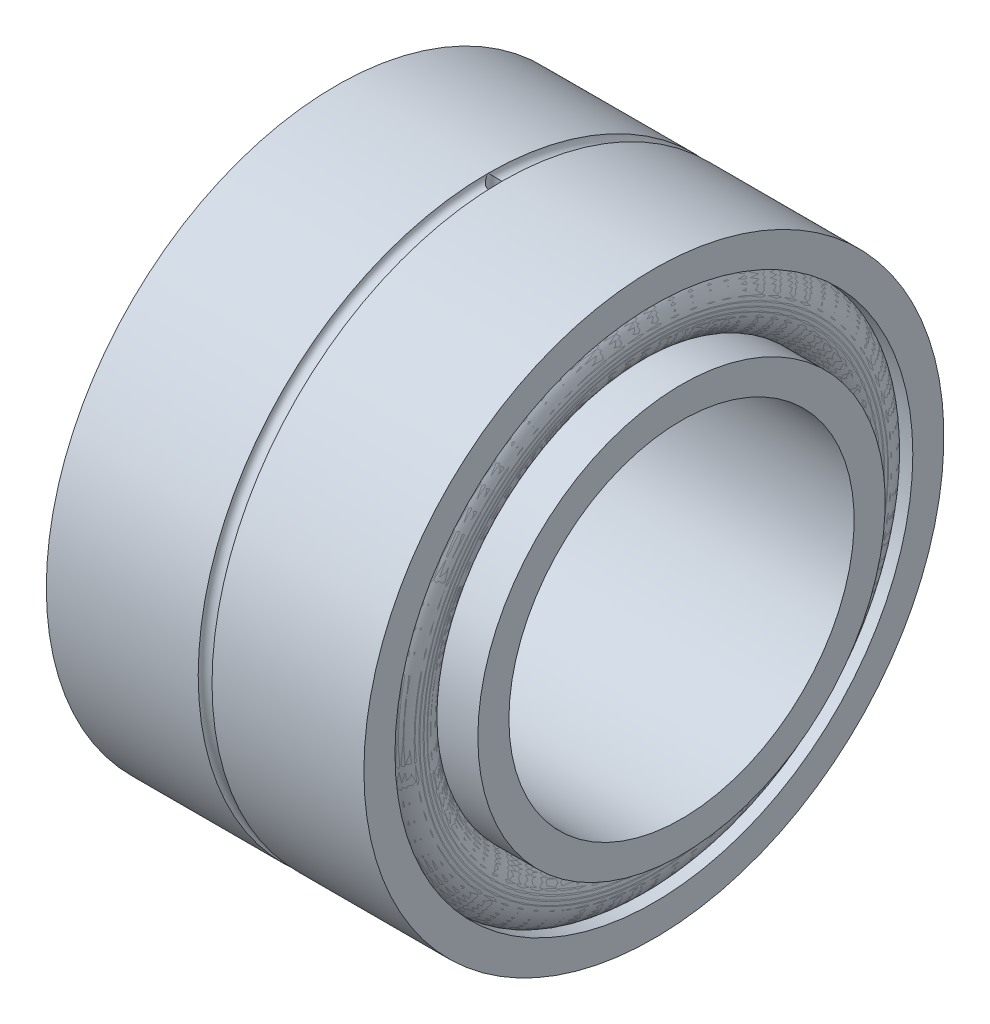
from build123d import *

# Parameters (mm, degrees)
SKIZZE1_R                       = 2.5
SKIZZE1_W                       = 14.985667851
SKIZZE1_H                       = 5
SKIZZE2_R                       = 0.5
SCHNITT_LINEAR_AUSTRAGEN1_DEPTH = 10


with BuildPart() as part:
    # Skizze1 → Rotation1 (revolve)
    with BuildSketch(Plane.XY, mode=Mode.PRIVATE) as rotation1_sk:
        with BuildLine():
            Line((0, 14.75), (0, 12.5))
            Line((0, 12.5), (25, 12.5))
            Line((25, 12.5), (25, 14.75))
            Line((25, 14.75), (22, 14.75))
            ThreePointArc((22, 14.75), (22.999333925, 16.75), (22, 18.75))
            Line((22, 18.75), (23, 18.75))
            Line((23, 18.75), (23, 21))
            Line((23, 21), (12, 21))
            ThreePointArc((12, 21), (11.5, 20.5), (11, 21))
            Line((11, 21), (0, 21))
            Line((0, 21), (0, 18.75))
            Line((0, 18.75), (2, 18.75))
            Line((2, 18.75), (2, 14.75))
            Line((2, 14.75), (0, 14.75))
        make_face()
        with Locations((20.498333925, 16.75)):
            Circle(SKIZZE1_R, mode=Mode.SUBTRACT)
        with BuildLine():
            Line((16.996667851, 14.75), (16.996667851, 18.75))
            Line((16.996667851, 18.75), (18.996667851, 18.75))
            ThreePointArc((18.996667851, 18.75), (17.997333925, 16.75), (18.996667851, 14.75))
            Line((18.996667851, 14.75), (16.996667851, 14.75))
        make_face(mode=Mode.SUBTRACT)
        with Locations((9.502833926, 16.75)):
            Rectangle(SKIZZE1_W, SKIZZE1_H, mode=Mode.SUBTRACT)
    revolve(rotation1_sk.sketch.rotate(Axis((0, 0, 0), (1, 0, 0)), 90), axis=Axis((0, 0, 0), (1, 0, 0)))

    # Skizze2 → Schnitt-Linear austragen1 (cut)
    with BuildSketch(Plane(origin=(0, 21, 0), x_dir=(1, 0, 0), z_dir=(0, 1, 0))):
        with Locations(Location((11.5, 0, 0), (0, 0, 270))):
            Circle(SKIZZE2_R)
    extrude(amount=-SCHNITT_LINEAR_AUSTRAGEN1_DEPTH, mode=Mode.SUBTRACT)


solid = part.part
